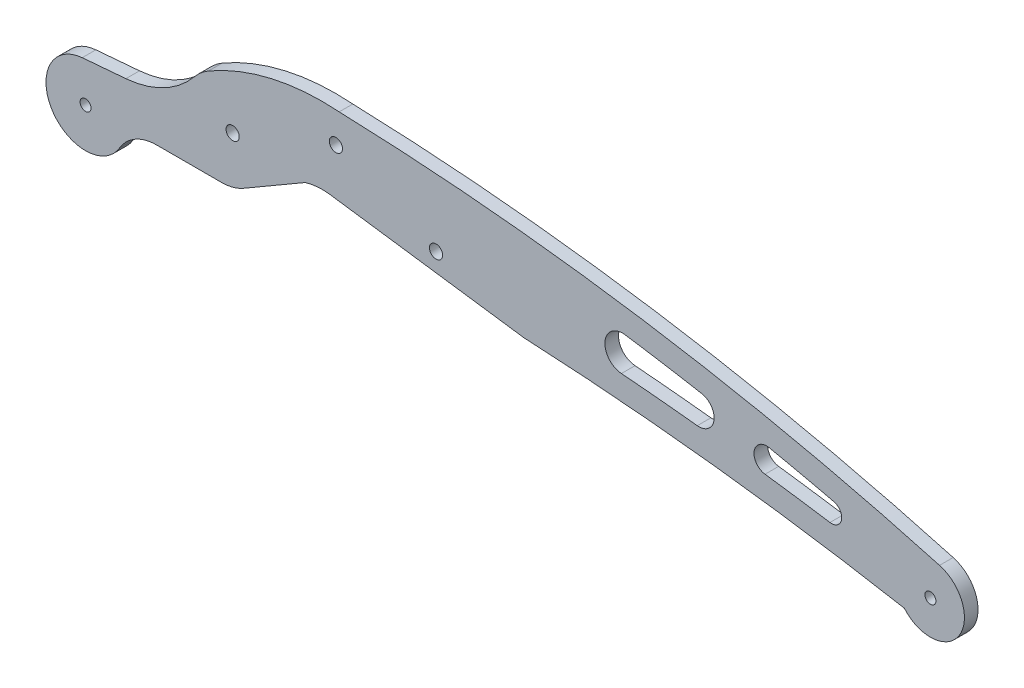
from build123d import *

# Parameters (mm, degrees)
SKETCH1_R           = 2.5
SKETCH1_R_2         = 3
BOSS_EXTRUDE1_DEPTH = 6.2


with BuildPart() as part:
    # Sketch1 → Boss-Extrude1 (new body)
    with BuildSketch(Plane.XY):
        with BuildLine():
            Line((85.6, -33.2), (-2.718519223, -20.878508118))
            ThreePointArc((-2.718519223, -20.878508118), (-8.41017463, -20.715920511), (-14, -21.8))
            Line((-14, -21.8), (-42.039824529, -38.092696265))
            ThreePointArc((-42.039824529, -38.092696265), (-46.884666341, -40.111316958), (-52.087842039, -40.8))
            Line((-52.087842039, -40.8), (-81.699109919, -40.8))
            ThreePointArc((-81.699109919, -40.8), (-91.370795398, -43.36753119), (-98.495572761, -50.394))
            ThreePointArc((-98.495572761, -50.394), (-129.24406218, -50.82175889), (-115.5, -23.312608885))
            Line((-115.5, -23.312608885), (-95.618089435, -21.65))
            ThreePointArc((-95.618089435, -21.65), (-78.309182519, -16.601252711), (-64.341378668, -5.2))
            ThreePointArc((-64.341378668, -5.2), (-61.413749232, -2.21456762), (-58, 0.2))
            ThreePointArc((-58, 0.2), (-29.282001226, 11.518177334), (1.5, 13.818827736))
            ThreePointArc((1.5, 13.818827736), (139.454874424, 0.958251967), (274.87829908, -28.323787594))
            ThreePointArc((274.87829908, -28.323787594), (283.738974288, -51.630641354), (258.857280718, -53.25))
            ThreePointArc((258.857280718, -53.25), (172.558903288, -40.371111866), (85.6, -33.2))
        make_face()
        with Locations(Location((-114, -41.25, 0), (0, 0, 180))):
            Circle(SKETCH1_R, mode=Mode.SUBTRACT)
        with Locations(Location((270.7, -43.25, 0), (0, 0, 180))):
            Circle(SKETCH1_R, mode=Mode.SUBTRACT)
        with Locations(Location((-47, -18.8, 0), (0, 0, 180))):
            Circle(SKETCH1_R_2, mode=Mode.SUBTRACT)
        with Locations(Location((45.6, -19.2, 0), (0, 0, 180))):
            Circle(SKETCH1_R_2, mode=Mode.SUBTRACT)
        with Locations(Location((0, 0, 0), (0, 0, 180))):
            Circle(SKETCH1_R_2, mode=Mode.SUBTRACT)
        with BuildLine():
            ThreePointArc((226.744224082, -27.259797753), (211.929816899, -23.860779344), (197.071572094, -20.658819377))
            ThreePointArc((197.071572094, -20.658819377), (190.434794526, -25.546132018), (195.40651845, -32.119913468))
            ThreePointArc((195.40651845, -32.119913468), (210.197393834, -34.160215491), (224.964543777, -36.365688118))
            ThreePointArc((224.964543777, -36.365688118), (230.232403999, -32.668395241), (226.744224082, -27.259797753))
        make_face(mode=Mode.SUBTRACT)
        with BuildLine():
            ThreePointArc((132.347185699, -9.089339403), (122.571709195, -15.840894216), (130.010518711, -25.104130489))
            ThreePointArc((130.010518711, -25.104130489), (147.296090717, -26.642266435), (164.560225388, -28.404797523))
            ThreePointArc((164.560225388, -28.404797523), (172.152990765, -22.51669502), (166.534944909, -14.721991823))
            ThreePointArc((166.534944909, -14.721991823), (149.462384392, -11.776267989), (132.347185699, -9.089339403))
        make_face(mode=Mode.SUBTRACT)
    extrude(amount=BOSS_EXTRUDE1_DEPTH)


solid = part.part
